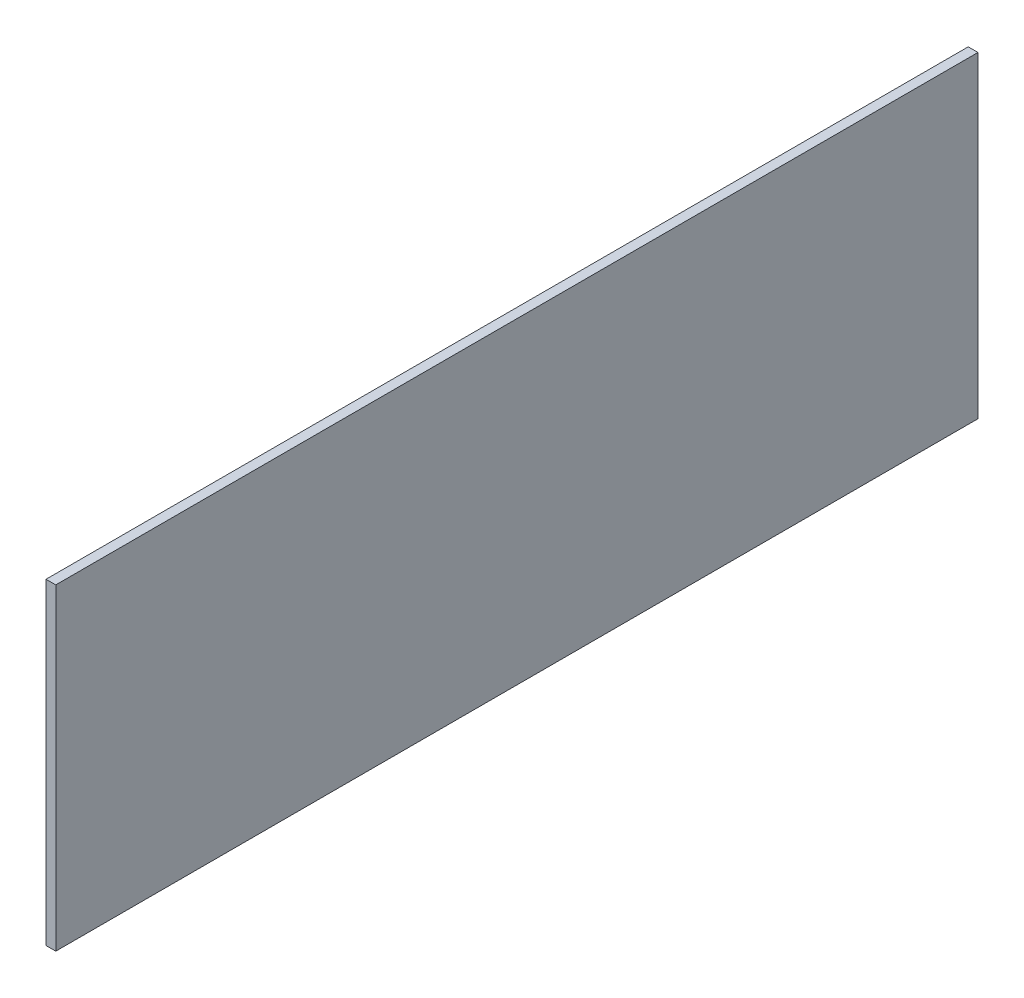
from build123d import *

# Parameters (mm, degrees)
SKETCH1_W           = 1.143
SKETCH1_H           = 37.132967143
BOSS_EXTRUDE1_DEPTH = 107.95


with BuildPart() as part:
    # Sketch1 → Boss-Extrude1 (new body)
    with BuildSketch(Plane.XY):
        with Locations((7463.035633005, 3556.51118666)):
            Rectangle(SKETCH1_W, SKETCH1_H)
    extrude(amount=BOSS_EXTRUDE1_DEPTH)


solid = part.part
